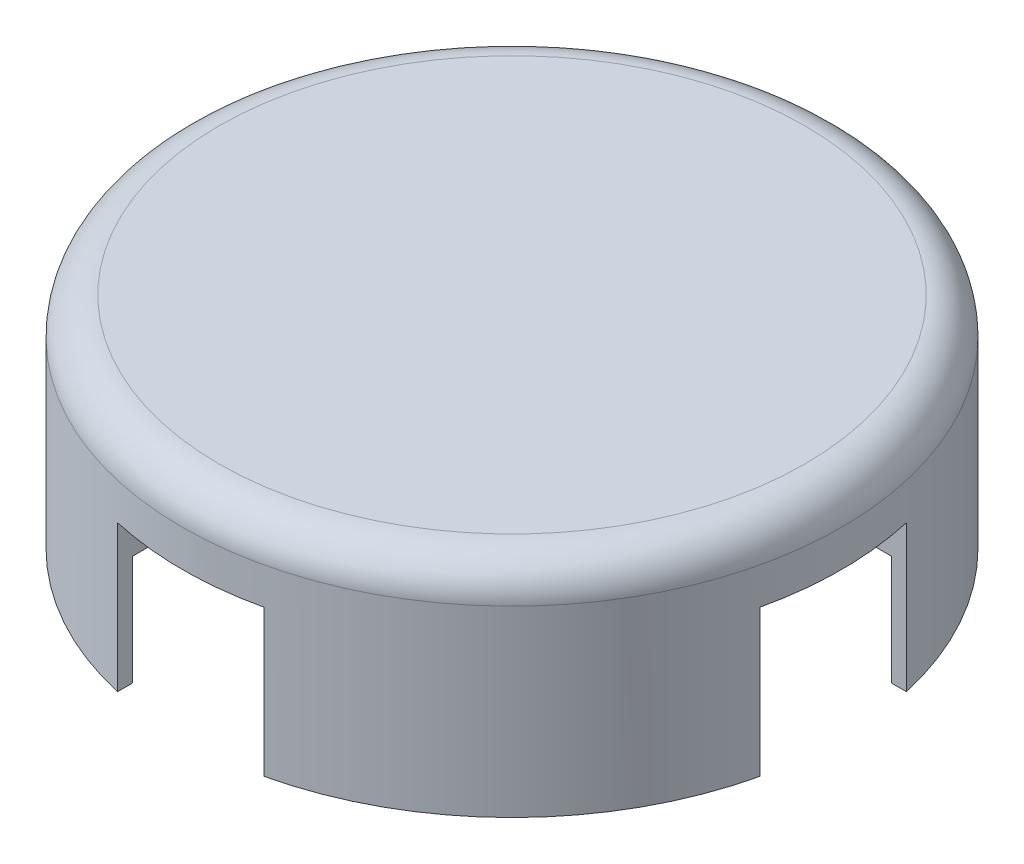
from build123d import *

# Parameters (mm, degrees)
SKETCH_1_R             = 45
EXTRUDE_1_DEPTH        = 30
SKETCH_2_R             = 43
CUT_EXTRUDE_1_DEPTH    = 15
CUT_EXTRUDE_2_DEPTH    = 20
FILLET_1_R             = 5
HOLE_WIZARD_M6_1_D     = 5
HOLE_WIZARD_M6_1_DEPTH = 13
HOLE_WIZARD_M6_1_TIP   = 1.502151548
HOLE_WIZARD_M4_1_D     = 3.3
HOLE_WIZARD_M4_1_DEPTH = 8
HOLE_WIZARD_M4_1_TIP   = 0.991420021


with BuildPart() as part:
    # 草圖1 → 填料-伸長1 (new body)
    with BuildSketch(Plane(origin=(0, 0, 0), x_dir=(1, 0, 0), z_dir=(0, 1, 0))):
        with Locations(Location((0, 0, 0), (0, 0, 270))):
            Circle(SKETCH_1_R)
    extrude(amount=EXTRUDE_1_DEPTH)

    # 草圖2 → 除料-伸長1 (cut)
    with BuildSketch(Plane(origin=(0, 0, 0), x_dir=(-1, 0, 0), z_dir=(0, -1, 0))):
        with Locations(Location((0, 0, 0), (0, 0, 90))):
            Circle(SKETCH_2_R)
    extrude(amount=-CUT_EXTRUDE_1_DEPTH, mode=Mode.SUBTRACT)

    # 草圖3 → 除料-伸長2 (cut)
    with BuildSketch(Plane.XZ):
        Polygon((-47.5, 10), (-10, 10), (-10, 47.5), (10, 47.5), (10, 10), (47.5, 10), (47.5, -10), (10, -10), (10, -47.5), (-10, -47.5), (-10, -10), (-47.5, -10), align=None)
    extrude(amount=-CUT_EXTRUDE_2_DEPTH, mode=Mode.SUBTRACT)

    # 圓角1
    fillet_1_edges = [part.edges().sort_by_distance(p)[0] for p in [
        (0, 30, -45),
    ]]
    fillet(fillet_1_edges, radius=FILLET_1_R)

    # M6 螺紋孔1
    with Locations(Plane(origin=(0, 15, 0), x_dir=(-1, 0, 0), z_dir=(0, -1, 0))):
        with Locations((21.213203436, -21.213203436), (-21.213203436, 21.213203436), (-21.213203436, -21.213203436), (21.213203436, 21.213203436)):
            Hole(HOLE_WIZARD_M6_1_D / 2, depth=HOLE_WIZARD_M6_1_DEPTH)
            with Locations((0, 0, -(HOLE_WIZARD_M6_1_DEPTH + HOLE_WIZARD_M6_1_TIP / 2))):  # 118° drill point
                Cone(0, HOLE_WIZARD_M6_1_D / 2, HOLE_WIZARD_M6_1_TIP, mode=Mode.SUBTRACT)

    # M4 螺紋孔1
    with Locations(Plane(origin=(0, 20, 0), x_dir=(-1, 0, 0), z_dir=(0, -1, 0))):
        with Locations((0, -30), (0, 30), (30, 0), (-30, 0)):
            Hole(HOLE_WIZARD_M4_1_D / 2, depth=HOLE_WIZARD_M4_1_DEPTH)
            with Locations((0, 0, -(HOLE_WIZARD_M4_1_DEPTH + HOLE_WIZARD_M4_1_TIP / 2))):  # 118° drill point
                Cone(0, HOLE_WIZARD_M4_1_D / 2, HOLE_WIZARD_M4_1_TIP, mode=Mode.SUBTRACT)


solid = part.part
